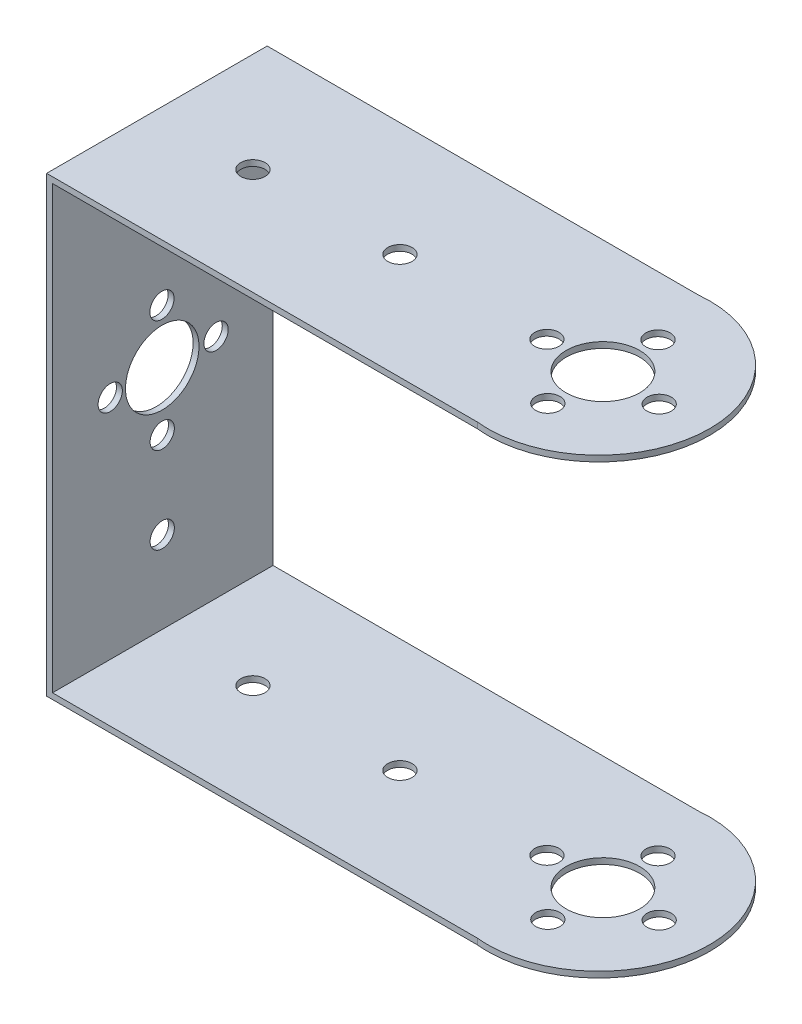
from build123d import *

# Parameters (mm, degrees)
SKETCH1_W           = 60
SKETCH1_H           = 30
BOSS_EXTRUDE3_DEPTH = 0.8
SKETCH4_W           = 0.8
SKETCH4_H           = 30
BOSS_EXTRUDE5_DEPTH = 30
SKETCH5_RX          = 15.076743355
SKETCH5_RY          = 15.045734075
BOSS_EXTRUDE6_DEPTH = 0.8
SKETCH6_R           = 5
SKETCH6_R_2         = 1.65
CUT_EXTRUDE2_DEPTH  = 10
SKETCH7_R           = 5
SKETCH7_R_2         = 1.65
CUT_EXTRUDE3_DEPTH  = 10


with BuildPart() as part:
    # Sketch1 → Boss-Extrude3 (new body)
    with BuildSketch(Plane(origin=(0, 0, 0), x_dir=(1, 0, 0), z_dir=(0, 1, 0))):
        with Locations((-9.504950495, -18.811881188)):
            Rectangle(SKETCH1_W, SKETCH1_H)
    extrude(amount=BOSS_EXTRUDE3_DEPTH)

    # Sketch4 → Boss-Extrude5 (add)
    with BuildSketch(Plane(origin=(0, 0, 0), x_dir=(-1, 0, 0), z_dir=(0, -1, 0))):
        with Locations((39.104950495, -18.811881188)):
            Rectangle(SKETCH4_W, SKETCH4_H)
    extrude(amount=BOSS_EXTRUDE5_DEPTH)

    # Sketch5 → Boss-Extrude6 (add)
    with BuildSketch(Plane(origin=(0, 0, 0), x_dir=(-1, 0, 0), z_dir=(0, -1, 0))):
        with Locations(Location((-20.627248494, -18.811881188), (0, 0, -73.484297411))):
            Ellipse(SKETCH5_RX, SKETCH5_RY)
    extrude(amount=-BOSS_EXTRUDE6_DEPTH)

    # Sketch6 → Cut-Extrude2 (cut)
    with BuildSketch(Plane(origin=(0, 0, 0), x_dir=(-1, 0, 0), z_dir=(0, -1, 0))):
        with Locations(Location((-21.694340642, -19.337305604, 0), (0, 0, 90))):
            Circle(SKETCH6_R)
        with Locations(Location((-21.694340642, -26.827036376, 0), (0, 0, 90))):
            Circle(SKETCH6_R_2)
        with Locations(Location((-29.349644864, -19.337305604, 0), (0, 0, 90))):
            Circle(SKETCH6_R_2)
        with Locations(Location((-21.694340642, -11.841250602, 0), (0, 0, 90))):
            Circle(SKETCH6_R_2)
        with Locations(Location((-14.079805527, -19.337305604, 0), (0, 0, 90))):
            Circle(SKETCH6_R_2)
        with Locations(Location((5.920194473, -19.337305604, 0), (0, 0, 90))):
            Circle(SKETCH6_R_2)
        with Locations(Location((25.920194473, -19.337305604, 0), (0, 0, 90))):
            Circle(SKETCH6_R_2)
        with Locations((-30.261708207, -582.328950324)):
            Circle(SKETCH6_R)
        with Locations((-37.91701243, -582.328950324)):
            Circle(SKETCH6_R_2)
        with Locations((-30.261708207, -574.832895322)):
            Circle(SKETCH6_R_2)
        with Locations((-22.647173092, -582.328950324)):
            Circle(SKETCH6_R_2)
        with Locations((-2.647173092, -582.328950324)):
            Circle(SKETCH6_R_2)
        with Locations((17.352826908, -582.328950324)):
            Circle(SKETCH6_R_2)
    extrude(amount=-CUT_EXTRUDE2_DEPTH, mode=Mode.SUBTRACT)

    # Mirror1: part across plane


with BuildPart() as part_1:
    add(part.part)
    add(part.part.mirror(Plane(origin=(0, -30, 0), x_dir=(0, 0, 1), z_dir=(0, -1, 0))))

    # Sketch7 → Cut-Extrude3 (cut)
    with BuildSketch(Plane(origin=(-38.704950495, 0, 0), x_dir=(0, 0, -1), z_dir=(1, 0, 0))):
        with Locations((-18.886165754, -29.145727498)):
            Circle(SKETCH7_R)
        with Locations((-18.928301582, -21.786074369)):
            Circle(SKETCH7_R_2)
        with Locations((-11.568184027, -29.145727498)):
            Circle(SKETCH7_R_2)
        with Locations((-18.886165754, -37.098993576)):
            Circle(SKETCH7_R_2)
        with Locations((-25.962216175, -29.145727498)):
            Circle(SKETCH7_R_2)
        with Locations((-18.928301582, -8.670402783)):
            Circle(SKETCH7_R_2)
        with Locations((-18.886165754, -48.835170272)):
            Circle(SKETCH7_R_2)
    extrude(amount=-CUT_EXTRUDE3_DEPTH, mode=Mode.SUBTRACT)


solid = part_1.part
